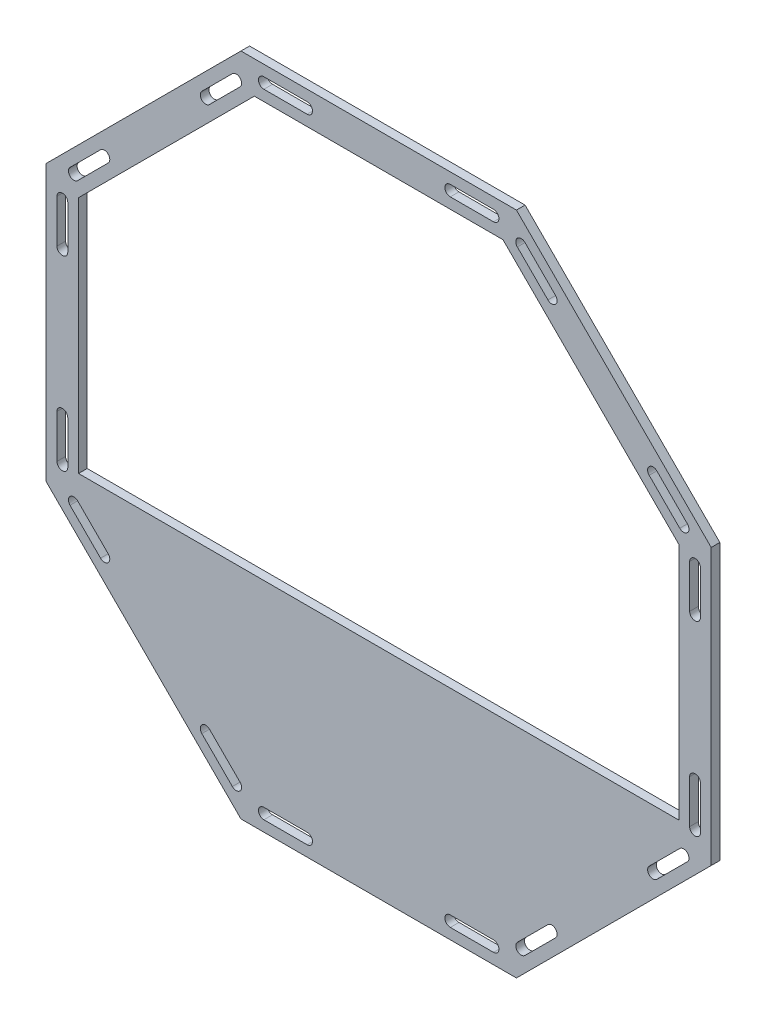
from build123d import *

# Parameters (mm, degrees)
BOSS_EXTRUDE1_DEPTH     = 8
ENL_V_MAT_EXTRU_2_DEPTH = 10
ENL_V_MAT_EXTRU_3_DEPTH = 10


with BuildPart() as part:
    # Sketch1 → Boss-Extrude1 (new body)
    with BuildSketch(Plane.XY):
        Polygon((307.812229203, -127.5), (307.812229203, 127.5), (127.5, 307.812229203), (-127.5, 307.812229203), (-307.812229203, 127.5), (-307.812229203, -127.5), (-127.5, -307.812229203), (127.5, -307.812229203), align=None)
    extrude(amount=BOSS_EXTRUDE1_DEPTH)

    # Esquisse2 → Enlèv. mat.-Extru.2 (cut)
    with BuildSketch(Plane.XY.offset(8)):
        Polygon((-277.812229203, 115.073593129), (-277.812229203, -106.028471395), (277.812229203, -106.028471395), (277.812229203, 115.073593129), (115.073593129, 277.812229203), (-115.073593129, 277.812229203), align=None)
    extrude(amount=-ENL_V_MAT_EXTRU_2_DEPTH, mode=Mode.SUBTRACT)

    # Esquisse3 → Enlèv. mat.-Extru.3 (cut)
    with BuildSketch(Plane.XY.offset(8)):
        with BuildLine():
            Line((-285.725345882, 135.391380688), (-257.441074635, 163.675651935))
            ThreePointArc((-257.441074635, 163.675651935), (-250.370006823, 163.675651935), (-250.370006823, 156.604584124))
            Line((-250.370006823, 156.604584124), (-278.65427807, 128.320312876))
            ThreePointArc((-278.65427807, 128.320312876), (-285.725345882, 128.320312876), (-285.725345882, 135.391380688))
        make_face()
        with BuildLine():
            Line((-135.413116679, 285.703609891), (-163.697387927, 257.419338643))
            ThreePointArc((-163.697387927, 257.419338643), (-163.697387927, 250.348270831), (-156.626320115, 250.348270831))
            Line((-156.626320115, 250.348270831), (-128.342048868, 278.632542079))
            ThreePointArc((-128.342048868, 278.632542079), (-128.342048868, 285.703609891), (-135.413116679, 285.703609891))
        make_face()
        with BuildLine():
            Line((-106.270981056, 297.774677702), (-66.270981056, 297.774677702))
            ThreePointArc((-66.270981056, 297.774677702), (-61.270981056, 292.774677702), (-66.270981056, 287.774677702))
            Line((-66.270981056, 287.774677702), (-106.270981056, 287.774677702))
            ThreePointArc((-106.270981056, 287.774677702), (-111.270981056, 292.774677702), (-106.270981056, 297.774677702))
        make_face()
        with BuildLine():
            Line((106.302612073, 297.774677702), (66.302612073, 297.774677702))
            ThreePointArc((66.302612073, 297.774677702), (61.302612073, 292.774677702), (66.302612073, 287.774677702))
            Line((66.302612073, 287.774677702), (106.302612073, 287.774677702))
            ThreePointArc((106.302612073, 287.774677702), (111.302612073, 292.774677702), (106.302612073, 297.774677702))
        make_face()
        with BuildLine():
            Line((-297.796413694, 106.249245064), (-297.796413694, 66.249245064))
            ThreePointArc((-297.796413694, 66.249245064), (-292.796413694, 61.249245064), (-287.796413694, 66.249245064))
            Line((-287.796413694, 66.249245064), (-287.796413694, 106.249245064))
            ThreePointArc((-287.796413694, 106.249245064), (-292.796413694, 111.249245064), (-297.796413694, 106.249245064))
        make_face()
        with BuildLine():
            Line((-297.796413694, -106.324348065), (-297.796413694, -66.324348065))
            ThreePointArc((-297.796413694, -66.324348065), (-292.796413694, -61.324348065), (-287.796413694, -66.324348065))
            Line((-287.796413694, -66.324348065), (-287.796413694, -106.324348065))
            ThreePointArc((-287.796413694, -106.324348065), (-292.796413694, -111.324348065), (-297.796413694, -106.324348065))
        make_face()
        with BuildLine():
            Line((285.756976899, -135.466483688), (257.472705652, -163.750754936))
            ThreePointArc((257.472705652, -163.750754936), (250.40163784, -163.750754936), (250.40163784, -156.679687124))
            Line((250.40163784, -156.679687124), (278.685909088, -128.395415876))
            ThreePointArc((278.685909088, -128.395415876), (285.756976899, -128.395415876), (285.756976899, -135.466483688))
        make_face()
        with BuildLine():
            Line((135.444747697, -285.778712891), (163.729018944, -257.494441643))
            ThreePointArc((163.729018944, -257.494441643), (163.729018944, -250.423373832), (156.657951132, -250.423373832))
            Line((156.657951132, -250.423373832), (128.373679885, -278.707645079))
            ThreePointArc((128.373679885, -278.707645079), (128.373679885, -285.778712891), (135.444747697, -285.778712891))
        make_face()
        with BuildLine():
            Line((106.302612073, -297.849780703), (66.302612073, -297.849780703))
            ThreePointArc((66.302612073, -297.849780703), (61.302612073, -292.849780703), (66.302612073, -287.849780703))
            Line((66.302612073, -287.849780703), (106.302612073, -287.849780703))
            ThreePointArc((106.302612073, -287.849780703), (111.302612073, -292.849780703), (106.302612073, -297.849780703))
        make_face()
        with BuildLine():
            Line((-106.270981056, -297.849780703), (-66.270981056, -297.849780703))
            ThreePointArc((-66.270981056, -297.849780703), (-61.270981056, -292.849780703), (-66.270981056, -287.849780703))
            Line((-66.270981056, -287.849780703), (-106.270981056, -287.849780703))
            ThreePointArc((-106.270981056, -287.849780703), (-111.270981056, -292.849780703), (-106.270981056, -297.849780703))
        make_face()
        with BuildLine():
            Line((-135.413116679, -285.778712891), (-163.697387927, -257.494441643))
            ThreePointArc((-163.697387927, -257.494441643), (-163.697387927, -250.423373832), (-156.626320115, -250.423373832))
            Line((-156.626320115, -250.423373832), (-128.342048868, -278.707645079))
            ThreePointArc((-128.342048868, -278.707645079), (-128.342048868, -285.778712891), (-135.413116679, -285.778712891))
        make_face()
        with BuildLine():
            Line((-285.725345882, -135.466483688), (-257.441074635, -163.750754936))
            ThreePointArc((-257.441074635, -163.750754936), (-250.370006823, -163.750754936), (-250.370006823, -156.679687124))
            Line((-250.370006823, -156.679687124), (-278.65427807, -128.395415876))
            ThreePointArc((-278.65427807, -128.395415876), (-285.725345882, -128.395415876), (-285.725345882, -135.466483688))
        make_face()
        with BuildLine():
            Line((297.828044711, -106.324348065), (297.828044711, -66.324348065))
            ThreePointArc((297.828044711, -66.324348065), (292.828044711, -61.324348065), (287.828044711, -66.324348065))
            Line((287.828044711, -66.324348065), (287.828044711, -106.324348065))
            ThreePointArc((287.828044711, -106.324348065), (292.828044711, -111.324348065), (297.828044711, -106.324348065))
        make_face()
        with BuildLine():
            Line((297.828044711, 106.249245064), (297.828044711, 66.249245064))
            ThreePointArc((297.828044711, 66.249245064), (292.828044711, 61.249245064), (287.828044711, 66.249245064))
            Line((287.828044711, 66.249245064), (287.828044711, 106.249245064))
            ThreePointArc((287.828044711, 106.249245064), (292.828044711, 111.249245064), (297.828044711, 106.249245064))
        make_face()
        with BuildLine():
            Line((135.444747697, 285.703609891), (163.729018944, 257.419338643))
            ThreePointArc((163.729018944, 257.419338643), (163.729018944, 250.348270831), (156.657951132, 250.348270831))
            Line((156.657951132, 250.348270831), (128.373679885, 278.632542079))
            ThreePointArc((128.373679885, 278.632542079), (128.373679885, 285.703609891), (135.444747697, 285.703609891))
        make_face()
        with BuildLine():
            Line((285.756976899, 135.391380688), (257.472705652, 163.675651935))
            ThreePointArc((257.472705652, 163.675651935), (250.40163784, 163.675651935), (250.40163784, 156.604584124))
            Line((250.40163784, 156.604584124), (278.685909088, 128.320312876))
            ThreePointArc((278.685909088, 128.320312876), (285.756976899, 128.320312876), (285.756976899, 135.391380688))
        make_face()
    extrude(amount=-ENL_V_MAT_EXTRU_3_DEPTH, mode=Mode.SUBTRACT)


solid = part.part
